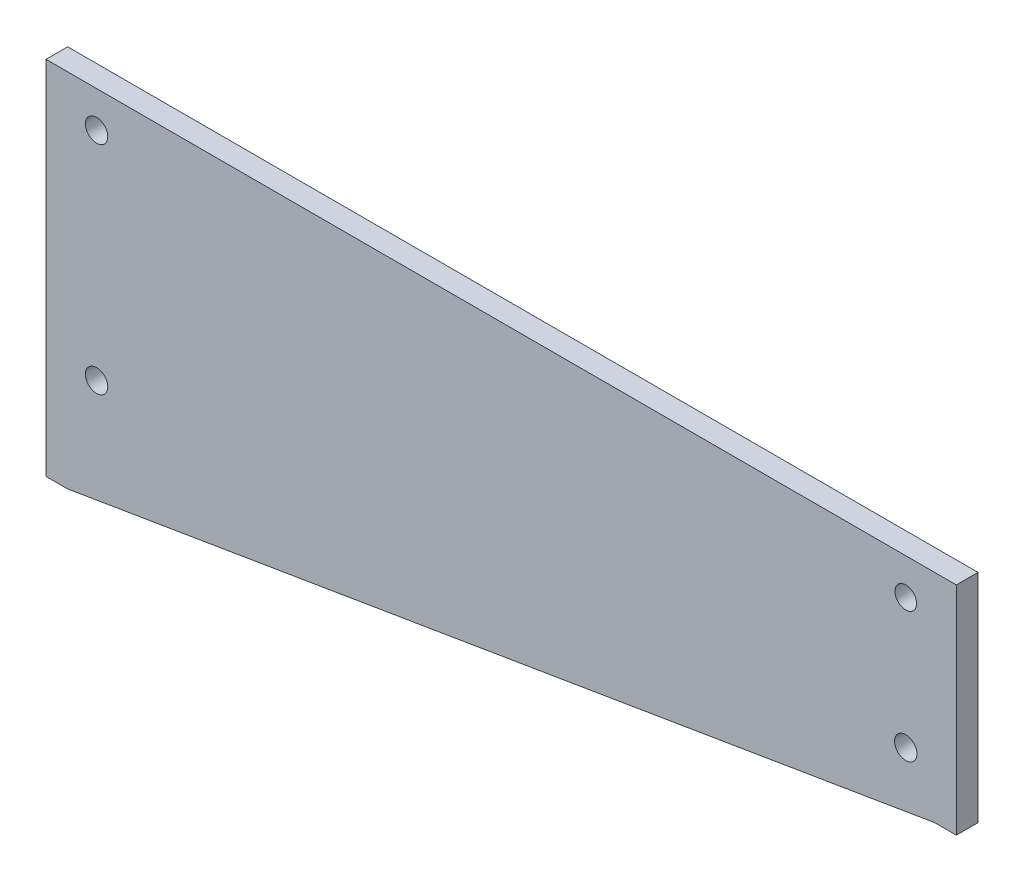
from build123d import *

# Parameters (mm, degrees)
SKETCH_1_W          = 126
SKETCH_1_H          = 53
EXTRUDE_1_DEPTH     = 3
SKETCH_2_R          = 1.55
SKETCH_2_R_2        = 1.5
CUT_EXTRUDE_1_DEPTH = 10
SKETCH_3_R          = 1.55
CUT_EXTRUDE_2_DEPTH = 10
SKETCH_5_R          = 1.55
CUT_EXTRUDE_5_DEPTH = 10
CUT_EXTRUDE_7_DEPTH = 69.412352686


with BuildPart() as part:
    # 草图1 → 凸台-拉伸1 (new body)
    with BuildSketch(Plane.XY):
        Rectangle(SKETCH_1_W, SKETCH_1_H)
    extrude(amount=EXTRUDE_1_DEPTH)

    # 草图2 → 切除-拉伸1 (cut)
    with BuildSketch(Plane(origin=(0, 0, 0), x_dir=(-1, 0, 0), z_dir=(0, 0, -1))):
        with Locations((56, 21.5)):
            Circle(SKETCH_2_R)
        with Locations((-56, 21.5)):
            Circle(SKETCH_2_R_2)
    extrude(amount=-CUT_EXTRUDE_1_DEPTH, mode=Mode.SUBTRACT)

    # 草图3 → 切除-拉伸2 (cut)
    with BuildSketch(Plane.XY.offset(3)):
        with Locations((-56, -8.5)):
            Circle(SKETCH_3_R)
        with Locations((56, -8.5)):
            Circle(SKETCH_3_R)
    extrude(amount=-CUT_EXTRUDE_2_DEPTH, mode=Mode.SUBTRACT)

    # 草图5 → 切除-拉伸5 (cut)
    with BuildSketch(Plane.XY.offset(3)):
        with Locations((56, 3.5)):
            Circle(SKETCH_5_R)
    extrude(amount=-CUT_EXTRUDE_5_DEPTH, mode=Mode.SUBTRACT)

    # 草图6 → 切除-拉伸7 (cut, through all)
    with BuildSketch(Plane.XY.offset(3)):
        Polygon((62.980435582, -3.5), (60, -3.5), (-60, -23.5), (-63, -23.5), (-63, -26.5), (63, -26.5), (63, -3.5), align=None)
    extrude(amount=-CUT_EXTRUDE_7_DEPTH, mode=Mode.SUBTRACT)


solid = part.part
